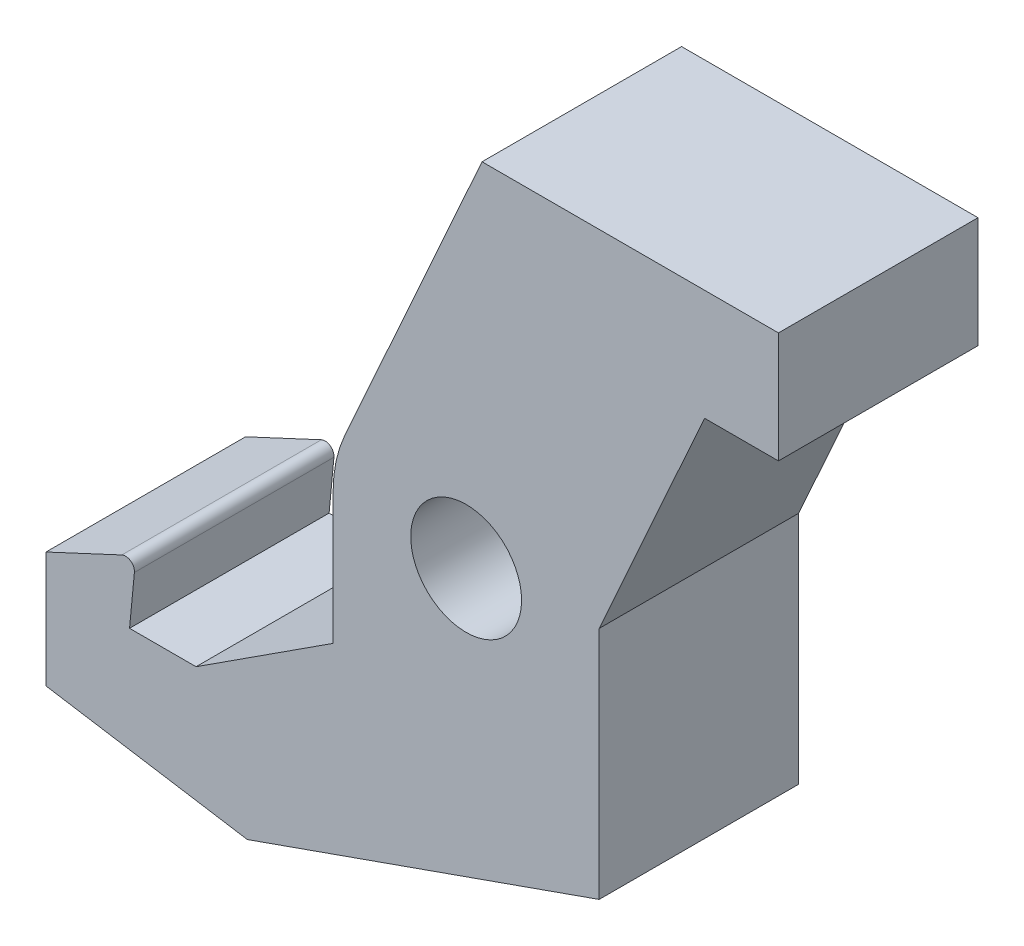
from build123d import *

# Parameters (mm, degrees)
SKETCH_1_R      = 2.5
EXTRUDE_1_DEPTH = 9


with BuildPart() as part:
    # 스케치1 → 보스-돌출1 (new body)
    with BuildSketch(Plane.XY):
        with BuildLine():
            Line((-6, 0), (-6, -5.928252217))
            Line((-6, -5.928252217), (-12.181462163, -9.930872029))
            Line((-12.181462163, -9.930872029), (-15.181462163, -9.930872029))
            Line((-15.181462163, -9.930872029), (-14.962549322, -7.64046453))
            ThreePointArc((-14.962549322, -7.64046453), (-15.12996585, -7.275687064), (-15.529724639, -7.239856856))
            Line((-15.529724639, -7.239856856), (-18.949704861, -8.833960932))
            Line((-18.949704861, -8.833960932), (-18.949704861, -12.404351558))
            Line((-18.949704861, -12.404351558), (-18.949704861, -14.067418225))
            Line((-18.949704861, -14.067418225), (-9.871536241, -15.526817987))
            Line((-9.871536241, -15.526817987), (6, -9.930872029))
            Line((6, -9.930872029), (6, 0.655573526))
            Line((6, 0.655573526), (10.754294738, 11.24201908))
            Line((10.754294738, 11.24201908), (14.08643491, 11.24201908))
            Line((14.08643491, 11.24201908), (14.08643491, 16.24201908))
            Line((14.08643491, 16.24201908), (0.716889728, 16.24201908))
            Line((0.716889728, 16.24201908), (-5.473385983, 2.458057338))
            ThreePointArc((-5.473385983, 2.458057338), (-5.866869519, 1.256917678), (-6, 0))
        make_face()
        Circle(SKETCH_1_R, mode=Mode.SUBTRACT)
    extrude(amount=EXTRUDE_1_DEPTH)


solid = part.part
